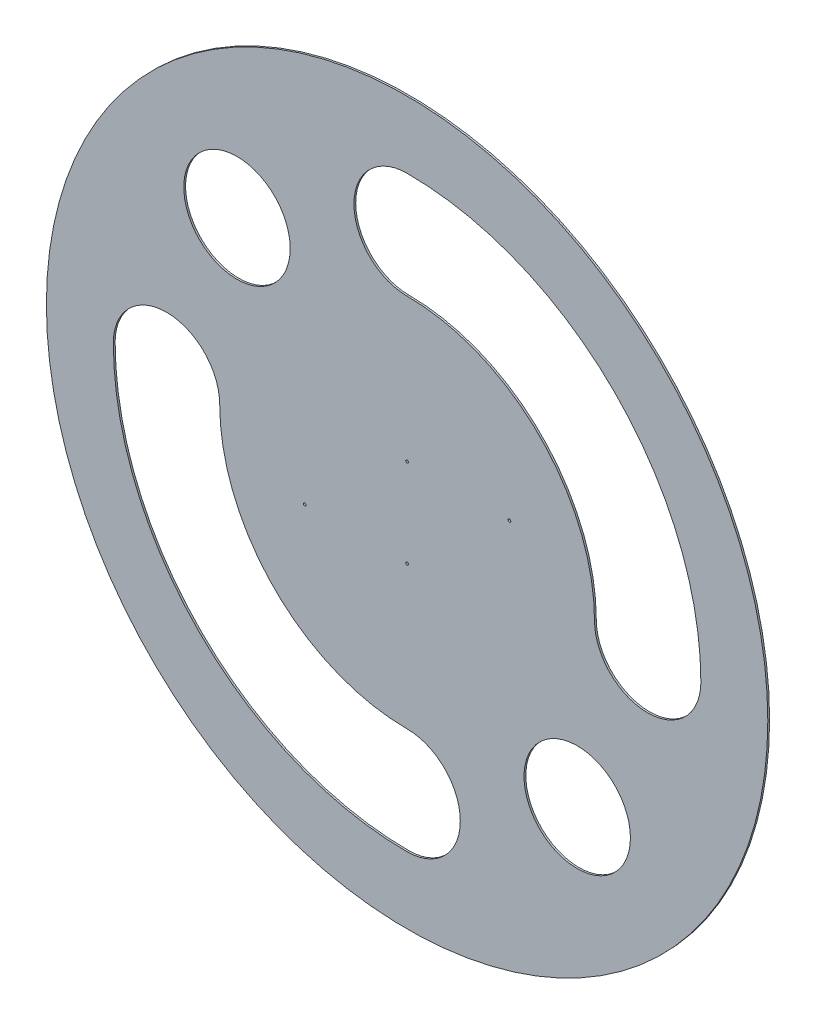
from build123d import *

# Parameters (mm, degrees)
SKETCH_1_R      = 400
SKETCH_1_R_2    = 1.5
SKETCH_1_R_3    = 59
EXTRUDE_1_DEPTH = 2


with BuildPart() as part:
    # 草图1 → 凸台-拉伸1 (new body)
    with BuildSketch(Plane.XY):
        Circle(SKETCH_1_R)
        with Locations((0, -49)):
            Circle(SKETCH_1_R_2, mode=Mode.SUBTRACT)
        with Locations((0, 49)):
            Circle(SKETCH_1_R_2, mode=Mode.SUBTRACT)
        with Locations((-113.5, -49)):
            Circle(SKETCH_1_R_2, mode=Mode.SUBTRACT)
        with Locations((113.5, 49)):
            Circle(SKETCH_1_R_2, mode=Mode.SUBTRACT)
        with Locations((-188.645478562, 188.645478562)):
            Circle(SKETCH_1_R_3, mode=Mode.SUBTRACT)
        with Locations((188.645478562, -188.645478562)):
            Circle(SKETCH_1_R_3, mode=Mode.SUBTRACT)
        with BuildLine():
            ThreePointArc((-325.763672953, 0), (-230.349702209, -230.349702209), (0, -325.763672953))
            ThreePointArc((0, -325.763672953), (58.97867869, -266.784994263), (0, -207.806315572))
            ThreePointArc((0, -207.806315572), (-146.941254915, -146.941254915), (-207.806315572, 0))
            ThreePointArc((-207.806315572, 0), (-266.784994263, 58.97867869), (-325.763672953, 0))
        make_face(mode=Mode.SUBTRACT)
        with BuildLine():
            ThreePointArc((0, 325.763672953), (230.349702209, 230.349702209), (325.763672953, 0))
            ThreePointArc((325.763672953, 0), (266.784994263, -58.97867869), (207.806315572, 0))
            ThreePointArc((207.806315572, 0), (146.941254915, 146.941254915), (0, 207.806315572))
            ThreePointArc((0, 207.806315572), (-58.97867869, 266.784994263), (0, 325.763672953))
        make_face(mode=Mode.SUBTRACT)
    extrude(amount=EXTRUDE_1_DEPTH)


solid = part.part
